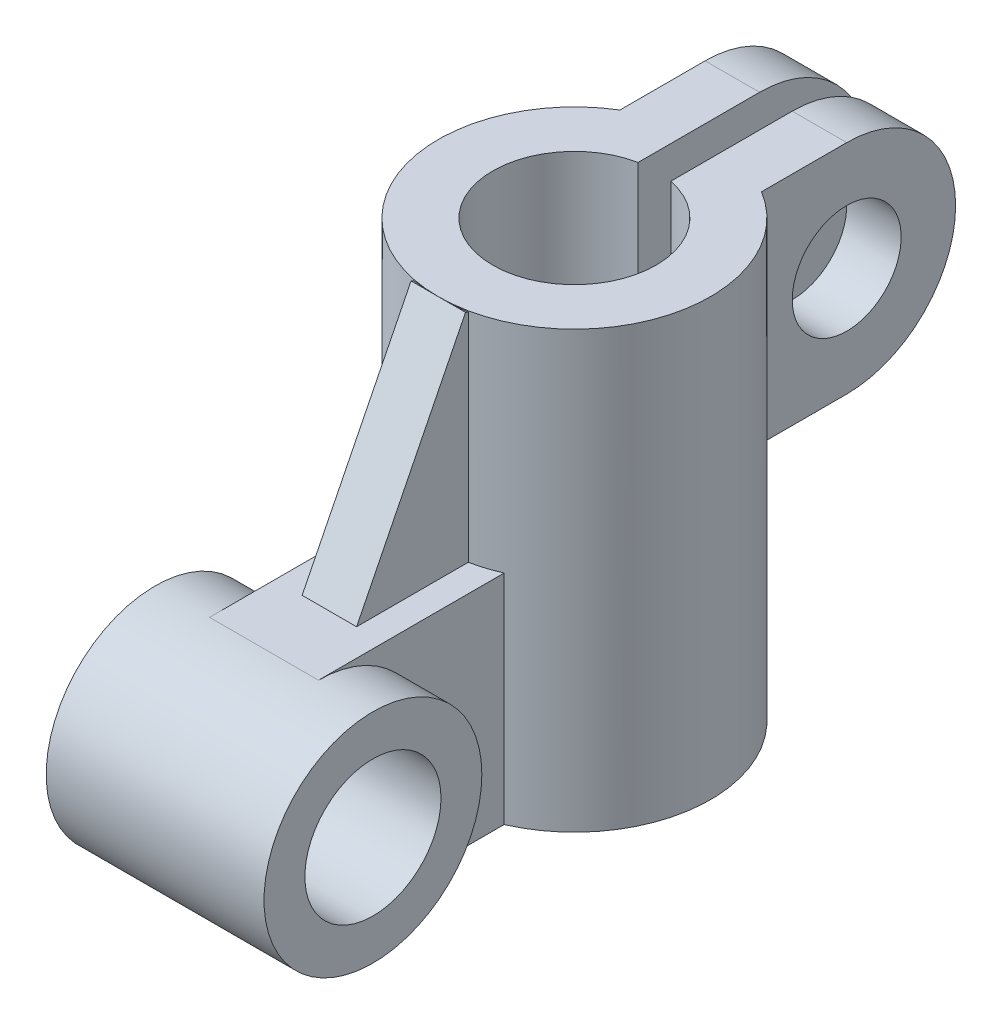
from build123d import *

# Parameters (mm, degrees)
BOSS_EXTRUDE1_DEPTH      = 40
BOSS_EXTRUDE1_DEPTH_BACK = 40
SKETCH1_R                = 25
SKETCH1_R_2              = 15
SKETCH2_R                = 10.000000000000002
BOSS_EXTRUDE2_DEPTH      = 13
SKETCH3_W                = 26.000000000000004
SKETCH3_H                = 40
BOSS_EXTRUDE3_DEPTH      = 3.645843
CUT_EXTRUDE1_DEPTH       = 102.36074190730847
BOSS_EXTRUDE4_DEPTH      = 10
SKETCH7_3_R              = 20
SKETCH7_3_R_2            = 12.500000000000002
BOSS_EXTRUDE5_DEPTH      = 20
SKETCH9_W                = 20
SKETCH9_H                = 40
BOSS_EXTRUDE6_DEPTH      = 2.087122
BOSS_EXTRUDE11_DEPTH     = 4.999999999999998


with BuildPart() as part:
    # Sketch1 → Boss-Extrude1 (new, two sides: drawn at the far end of the back side and taken through both)
    with BuildSketch(Plane(origin=(0, 0, 0), x_dir=(1, 0, 0), z_dir=(0, 1, 0)).offset(-BOSS_EXTRUDE1_DEPTH_BACK)):
        with Locations(Location((0, 0, 0), (0, 0, 270))):
            Circle(SKETCH1_R)
        with Locations(Location((0, 0, 0), (0, 0, 270))):
            Circle(SKETCH1_R_2, mode=Mode.SUBTRACT)
    extrude(amount=BOSS_EXTRUDE1_DEPTH + BOSS_EXTRUDE1_DEPTH_BACK)



with BuildPart() as body_2:
    # Sketch2 → Boss-Extrude2 (new, symmetric)
    with BuildSketch(Plane(origin=(0, 0, 0), x_dir=(0, 0, -1), z_dir=(1, 0, 0))):
        with BuildLine():
            Line((37, 40), (25, 40))
            Line((25, 40), (25, 0))
            Line((25, 0), (37, 0))
            ThreePointArc((37, 0), (57, 20), (37, 40))
        make_face()
        with Locations(Location((37, 20, 0), (0, 0, 180))):
            Circle(SKETCH2_R, mode=Mode.SUBTRACT)
    extrude(amount=BOSS_EXTRUDE2_DEPTH, both=True)


with BuildPart() as part_1:
    add(part.part)

    add(body_2.part)  # Boss-Extrude3 merges body 2
    # Sketch3 → Boss-Extrude3 (add)
    with BuildSketch(Plane.XY.offset(-25)):
        with Locations((0, 20)):
            Rectangle(SKETCH3_W, SKETCH3_H)
    extrude(amount=BOSS_EXTRUDE3_DEPTH)

    # Sketch4 → Cut-Extrude1 (cut, through all)
    with BuildSketch(Plane(origin=(0, 40, 0), x_dir=(1, 0, 0), z_dir=(0, 1, 0))):
        Polygon((-3.000000000000038, 151.757178913158), (2.9999999999999623, 151.75717891315796), (3.0000000000000093, -1.388e-14), (-2.999999999999991, -1.388e-14), align=None)
    extrude(amount=-CUT_EXTRUDE1_DEPTH, mode=Mode.SUBTRACT)



with BuildPart() as body_2_2:
    # Sketch7 → Boss-Extrude4 (new, symmetric)
    with BuildSketch(Plane(origin=(0, 0, 0), x_dir=(0, 0, -1), z_dir=(1, 0, 0))):
        with BuildLine():
            Line((-56.99999999999999, -40), (-25, -40))
            Line((-25, -40), (-25, 0))
            Line((-25, 0), (-56.99999999999999, 0))
            ThreePointArc((-56.99999999999999, 0), (-42.85786437626904, -5.857864376269051), (-36.99999999999999, -20))
            ThreePointArc((-36.99999999999999, -20.000000000000004), (-42.85786437626905, -34.14213562373095), (-57, -40))
        make_face()
    extrude(amount=BOSS_EXTRUDE4_DEPTH, both=True)

    # Sketch7<3> → Boss-Extrude5 (add, symmetric)
    with BuildSketch(Plane(origin=(0, 0, 0), x_dir=(0, 0, -1), z_dir=(1, 0, 0))):
        with Locations((-56.99999999999999, -20)):
            Circle(SKETCH7_3_R)
        with Locations((-56.99999999999999, -20)):
            Circle(SKETCH7_3_R_2, mode=Mode.SUBTRACT)
    extrude(amount=BOSS_EXTRUDE5_DEPTH, both=True)


with BuildPart() as part_2:
    add(part_1.part)

    add(body_2_2.part)  # Boss-Extrude6 merges body 2 2
    # Sketch9 → Boss-Extrude6 (add)
    with BuildSketch(Plane(origin=(0, 0, 25), x_dir=(-1, 0, 0), z_dir=(0, 0, -1))):
        with Locations((0, -20)):
            Rectangle(SKETCH9_W, SKETCH9_H)
    extrude(amount=BOSS_EXTRUDE6_DEPTH)

    # Sketch11 → Boss-Extrude11 (add, symmetric)
    with BuildSketch(Plane(origin=(0, 0, 0), x_dir=(0, 0, -1), z_dir=(1, 0, 0))):
        Polygon((-21.615437004072646, -2.0004940029139107), (-21.615437004072646, 38.49074239980155), (-25, 40), (-44.99999999999999, 0), (-44.99999999999999, -2.0004940029139107), align=None)
    extrude(amount=BOSS_EXTRUDE11_DEPTH, both=True)


solid = part_2.part
